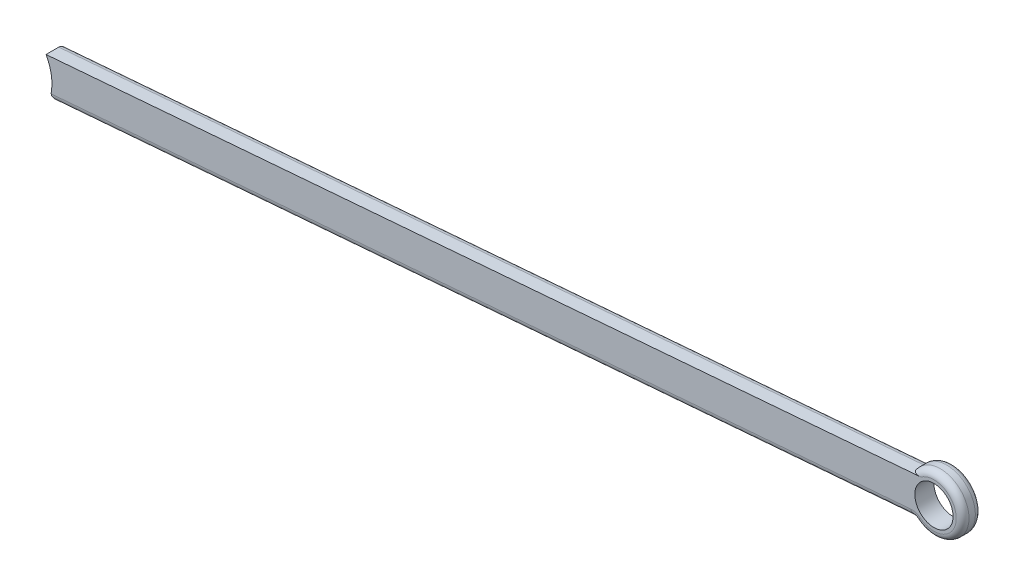
from build123d import *

# Parameters (mm, degrees)
BOSS_EXTRUDE1_DEPTH = 3
FILLET1_R           = 1


with BuildPart() as part:
    # Sketch3 → Boss-Extrude1 (new body)
    with BuildSketch(Plane.XY):
        with BuildLine():
            Line((-47.629341679, 303.619173128), (-183.385792378, 292.525025508))
            ThreePointArc((-183.385792378, 292.525025508), (-182.965818895, 291.654682353), (-182.667892931, 290.735380959))
            ThreePointArc((-182.667892931, 290.735380959), (-182.508640247, 289.879573849), (-182.455288816, 289.010712035))
            ThreePointArc((-182.455288816, 289.010712035), (-182.566613094, 287.758202235), (-182.897095731, 286.54496066))
            Line((-182.897095731, 286.54496066), (-47.140645032, 297.63910828))
            ThreePointArc((-47.140645032, 297.63910828), (-39.556986842, 301.268852919), (-47.629341679, 303.619173128))
        make_face()
        with BuildLine():
            ThreePointArc((-41.042035478, 300.902330434), (-41.836015876, 298.869234884), (-43.797687155, 297.91229801))
            ThreePointArc((-43.797687155, 297.91229801), (-45.953531927, 298.590149359), (-47.024676985, 300.580073327))
            ThreePointArc((-47.024676985, 300.580073327), (-44.203397618, 303.897987668), (-41.042035478, 300.902330434))
        make_face(mode=Mode.SUBTRACT)
    extrude(amount=BOSS_EXTRUDE1_DEPTH)

    # Fillet1
    fillet1_edges = [part.edges().sort_by_distance(p)[0] for p in [
        (-47.140645032, 297.63910828, 1.5),
        (-182.897095731, 286.54496066, 1.5),
        (-115.018870382, 292.09203447, 3),
        (-39.556986842, 301.268852919, 3),
        (-115.507567028, 298.072099318, 0),
        (-39.556986842, 301.268852919, 0),
        (-115.018870382, 292.09203447, 0),
    ]]
    fillet(fillet1_edges, radius=FILLET1_R)


solid = part.part
